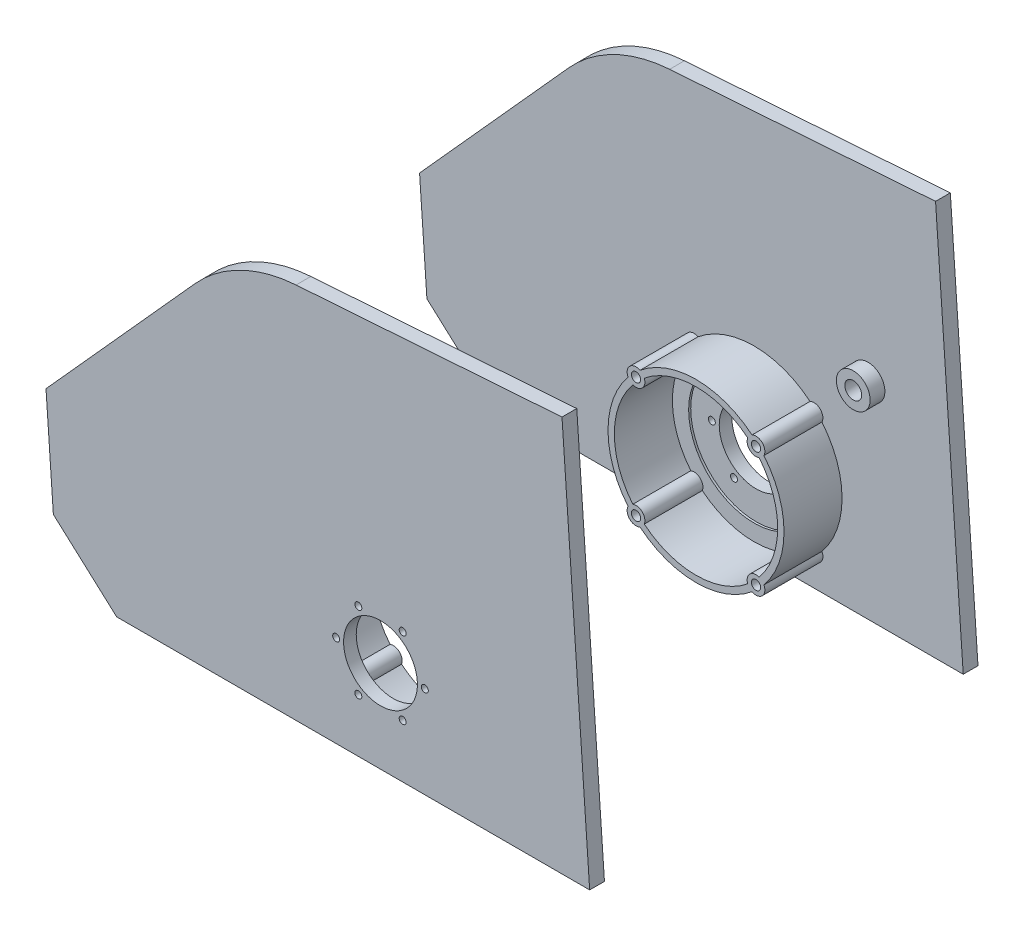
from build123d import *

# Parameters (mm, degrees)
BOSS_EXTRUDE1_DEPTH = 7
SKETCH2_R           = 31
CUT_EXTRUDE1_DEPTH  = 1
BOSS_EXTRUDE2_START = -1
BOSS_EXTRUDE2_DEPTH = 28.5
CUT_EXTRUDE3_START  = 27.5
SKETCH4_11_R        = 2.2
CUT_EXTRUDE3_DEPTH  = 6
SKETCH4_12_R        = 17.5
SKETCH4_12_R_2      = 1.65
CUT_EXTRUDE4_DEPTH  = 216.894975062
SKETCH2_13_R        = 8
BOSS_EXTRUDE3_DEPTH = 7
CUT_EXTRUDE5_START  = 7
SKETCH2_14_R        = 4
CUT_EXTRUDE5_DEPTH  = 7


with BuildPart() as part:
    # Sketch1 → Boss-Extrude1 (new body)
    with BuildSketch(Plane.XY):
        with BuildLine():
            Line((-158.487823687, 33.390323842), (-155, -16.487878671))
            Line((-155, -16.487878671), (-125, -43.5))
            Line((-125, -43.5), (99.111277239, -43.5))
            Line((99.111277239, -43.5), (86, 144))
            Line((86, 144), (-40, 135.189221695))
            ThreePointArc((-40, 135.189221695), (-66.184750191, 128.173039027), (-87.834519516, 111.858767669))
            Line((-87.834519516, 111.858767669), (-158.487823687, 33.390323842))
        make_face()
    extrude(amount=-BOSS_EXTRUDE1_DEPTH)

    # Sketch2 → Cut-Extrude1 (cut)
    with BuildSketch(Plane(origin=(0, 0, -7), x_dir=(-1, 0, 0), z_dir=(0, 0, -1))):
        Circle(SKETCH2_R)
    extrude(amount=-CUT_EXTRUDE1_DEPTH, mode=Mode.SUBTRACT)

    # Sketch4<9> → Boss-Extrude2 (add)
    with BuildSketch(Plane(origin=(0, 0, -7), x_dir=(-1, 0, 0), z_dir=(0, 0, -1)).offset(BOSS_EXTRUDE2_START)):
        with BuildLine():
            ThreePointArc((-26.528978176, 32.17302157), (-31.395541085, 31.395541085), (-32.17302157, 26.528978176))
            ThreePointArc((-32.17302157, 26.528978176), (-41.7, 0), (-32.17302157, -26.528978176))
            ThreePointArc((-32.17302157, -26.528978176), (-31.395541085, -31.395541085), (-26.528978176, -32.17302157))
            ThreePointArc((-26.528978176, -32.17302157), (0, -41.7), (26.528978176, -32.17302157))
            ThreePointArc((26.528978176, -32.17302157), (31.395541085, -31.395541085), (32.17302157, -26.528978176))
            ThreePointArc((32.17302157, -26.528978176), (41.7, 0), (32.17302157, 26.528978176))
            ThreePointArc((32.17302157, 26.528978176), (31.395541085, 31.395541085), (26.528978176, 32.17302157))
            ThreePointArc((26.528978176, 32.17302157), (0, 41.7), (-26.528978176, 32.17302157))
        make_face()
        with BuildLine():
            ThreePointArc((24.511306353, 29.948052706), (25.455844123, 25.455844123), (29.948052706, 24.511306353))
            ThreePointArc((29.948052706, 24.511306353), (38.7, 0), (29.948052706, -24.511306353))
            ThreePointArc((29.948052706, -24.511306353), (25.455844123, -25.455844123), (24.511306353, -29.948052706))
            ThreePointArc((24.511306353, -29.948052706), (0, -38.7), (-24.511306353, -29.948052706))
            ThreePointArc((-24.511306353, -29.948052706), (-25.455844123, -25.455844123), (-29.948052706, -24.511306353))
            ThreePointArc((-29.948052706, -24.511306353), (-38.7, 0), (-29.948052706, 24.511306353))
            ThreePointArc((-29.948052706, 24.511306353), (-25.455844123, 25.455844123), (-24.511306353, 29.948052706))
            ThreePointArc((-24.511306353, 29.948052706), (0, 38.7), (24.511306353, 29.948052706))
        make_face(mode=Mode.SUBTRACT)
    extrude(amount=BOSS_EXTRUDE2_DEPTH)

    # Sketch4<11> → Cut-Extrude3 (cut)
    with BuildSketch(Plane(origin=(0, 0, -7), x_dir=(-1, 0, 0), z_dir=(0, 0, -1)).offset(CUT_EXTRUDE3_START)):
        with Locations((-28.425692604, 28.425692604)):
            Circle(SKETCH4_11_R)
        with Locations((28.425692604, 28.425692604)):
            Circle(SKETCH4_11_R)
        with Locations((28.425692604, -28.425692604)):
            Circle(SKETCH4_11_R)
        with Locations((-28.425692604, -28.425692604)):
            Circle(SKETCH4_11_R)
    extrude(amount=-CUT_EXTRUDE3_DEPTH, mode=Mode.SUBTRACT)

    # Sketch4<12> → Cut-Extrude4 (cut, through all)
    with BuildSketch(Plane(origin=(0, 0, -7), x_dir=(-1, 0, 0), z_dir=(0, 0, -1))):
        Circle(SKETCH4_12_R)
        with Locations((-10.5, 18.186533479)):
            Circle(SKETCH4_12_R_2)
        with Locations((10.5, 18.186533479)):
            Circle(SKETCH4_12_R_2)
        with Locations((21, 0)):
            Circle(SKETCH4_12_R_2)
        with Locations((10.5, -18.186533479)):
            Circle(SKETCH4_12_R_2)
        with Locations((-10.5, -18.186533479)):
            Circle(SKETCH4_12_R_2)
        with Locations((-21, 0)):
            Circle(SKETCH4_12_R_2)
    extrude(amount=-CUT_EXTRUDE4_DEPTH, mode=Mode.SUBTRACT)

    # Sketch2<13> → Boss-Extrude3 (add)
    with BuildSketch(Plane(origin=(0, 0, -7), x_dir=(-1, 0, 0), z_dir=(0, 0, -1))):
        with Locations((-54, 54)):
            Circle(SKETCH2_13_R)
    extrude(amount=BOSS_EXTRUDE3_DEPTH)

    # Sketch2<14> → Cut-Extrude5 (cut)
    with BuildSketch(Plane(origin=(0, 0, -7), x_dir=(-1, 0, 0), z_dir=(0, 0, -1)).offset(CUT_EXTRUDE5_START)):
        with Locations((-54, 54)):
            Circle(SKETCH2_14_R)
    extrude(amount=-CUT_EXTRUDE5_DEPTH, mode=Mode.SUBTRACT)


with BuildPart() as body_2:
    # Mirror1: mirrored copy
    add(part.part.mirror(Plane.XY.offset(-92)))


solid = Compound([part.part, body_2.part])
